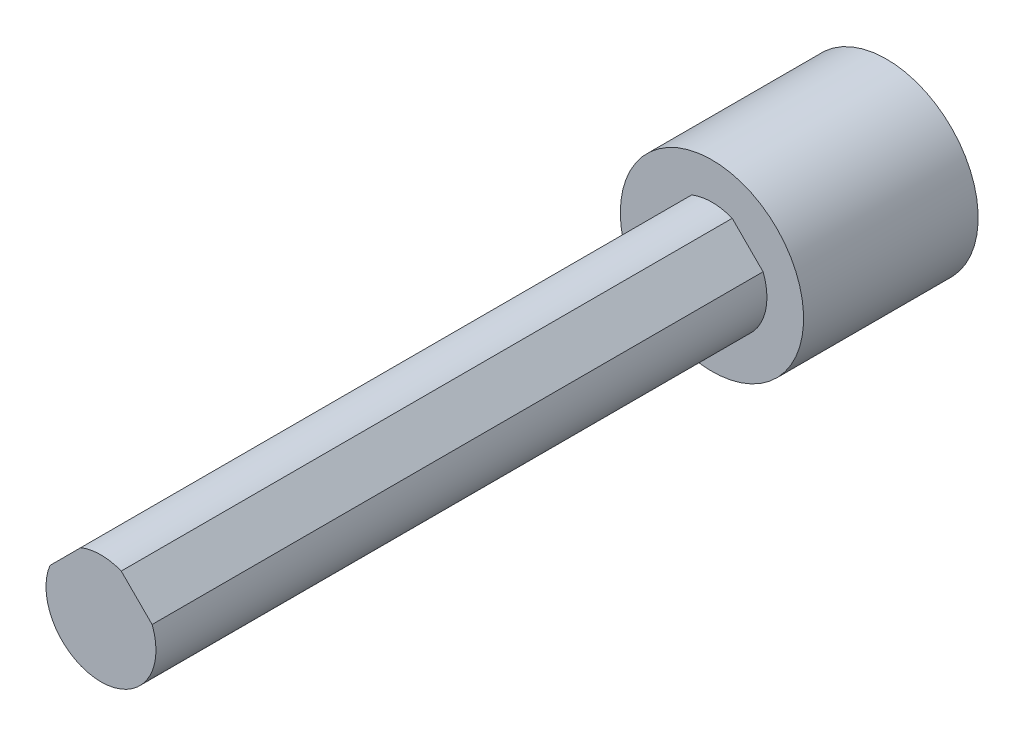
from build123d import *

# Parameters (mm, degrees)
BOSS_EXTRUDE1_DEPTH = 44.45
SKETCH2_R           = 6.6675
BOSS_EXTRUDE2_DEPTH = 12.7


with BuildPart() as part:
    # Sketch1 → Boss-Extrude1 (new body)
    with BuildSketch(Plane.XY):
        with BuildLine():
            Line((-1.473989119, 3.719053149), (-3.719053149, 1.473989119))
            ThreePointArc((-3.719053149, 1.473989119), (0, -4.0005), (3.719053149, 1.473989119))
            Line((3.719053149, 1.473989119), (1.473989119, 3.719053149))
            ThreePointArc((1.473989119, 3.719053149), (0, 4.0005), (-1.473989119, 3.719053149))
        make_face()
    extrude(amount=BOSS_EXTRUDE1_DEPTH)

    # Sketch2 → Boss-Extrude2 (add)
    with BuildSketch(Plane(origin=(0, 0, 0), x_dir=(-1, 0, 0), z_dir=(0, 0, -1))):
        Circle(SKETCH2_R)
    extrude(amount=BOSS_EXTRUDE2_DEPTH)


solid = part.part
